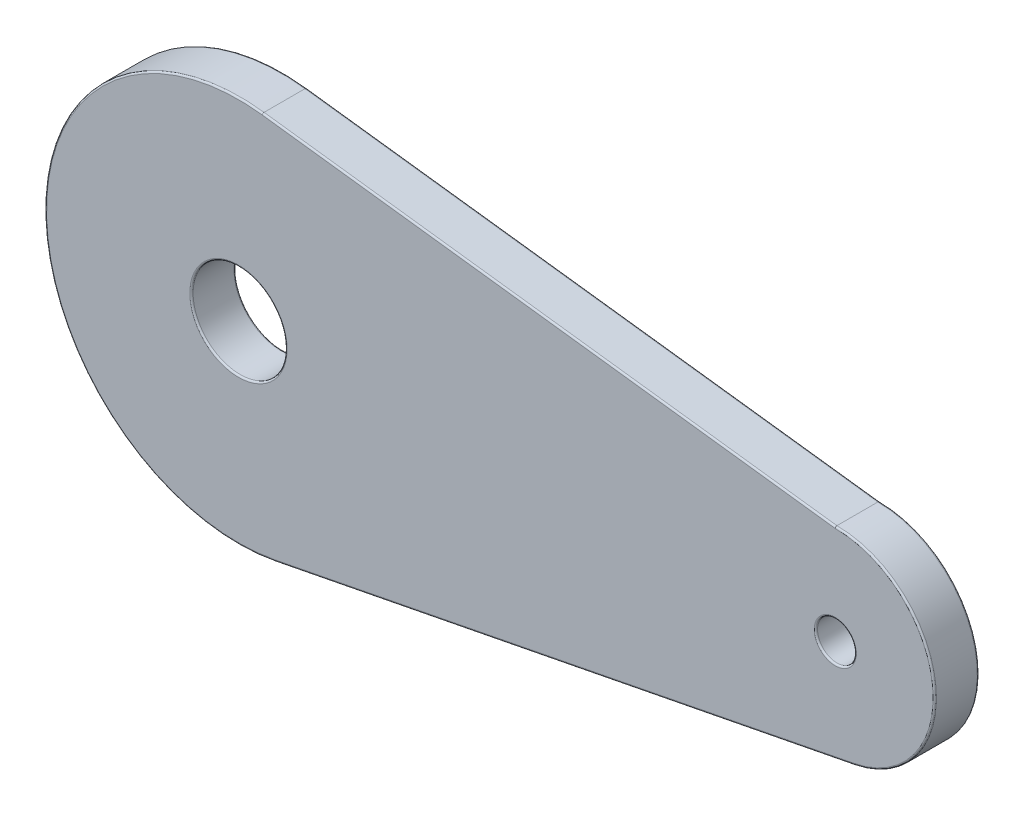
from build123d import *

# Parameters (mm, degrees)
SKETCH_2_R      = 4.25
SKETCH_2_R_2    = 1.75
EXTRUDE_1_DEPTH = 4
FILLET_1_R      = 0.15


with BuildPart() as part:
    # 草图2 → 凸台-拉伸1 (new body)
    with BuildSketch(Plane.XY):
        with BuildLine():
            Line((-18.051094567, 74.945075561), (33.746721757, 68.475505945))
            ThreePointArc((33.746721757, 68.475505945), (42.704773685, 60.343437773), (35.474494733, 50.642907202))
            Line((35.474494733, 50.642907202), (-16.860441437, 40.405502445))
            ThreePointArc((-16.860441437, 40.405502445), (-37.709611382, 56.977095602), (-18.051094567, 74.945075561))
        make_face()
        with Locations((-20.22, 57.58)):
            Circle(SKETCH_2_R, mode=Mode.SUBTRACT)
        with Locations((33.746721757, 59.475505945)):
            Circle(SKETCH_2_R_2, mode=Mode.SUBTRACT)
    extrude(amount=-EXTRUDE_1_DEPTH)

    # 圆角1
    fillet_1_edges = [part.edges().sort_by_distance(p)[0] for p in [
        (-24.47, 57.58, -4),
        (-24.47, 57.58, 0),
        (42.704773685, 60.343437773, -4),
        (31.996721757, 59.475505945, -4),
        (31.996721757, 59.475505945, 0),
        (7.847813595, 71.710290753, -4),
        (-37.709611382, 56.977095602, -4),
        (7.847813595, 71.710290753, 0),
        (42.704773685, 60.343437773, 0),
        (9.307026648, 45.524204824, 0),
        (-37.709611382, 56.977095602, 0),
        (9.307026648, 45.524204824, -4),
    ]]
    fillet(fillet_1_edges, radius=FILLET_1_R)


solid = part.part
